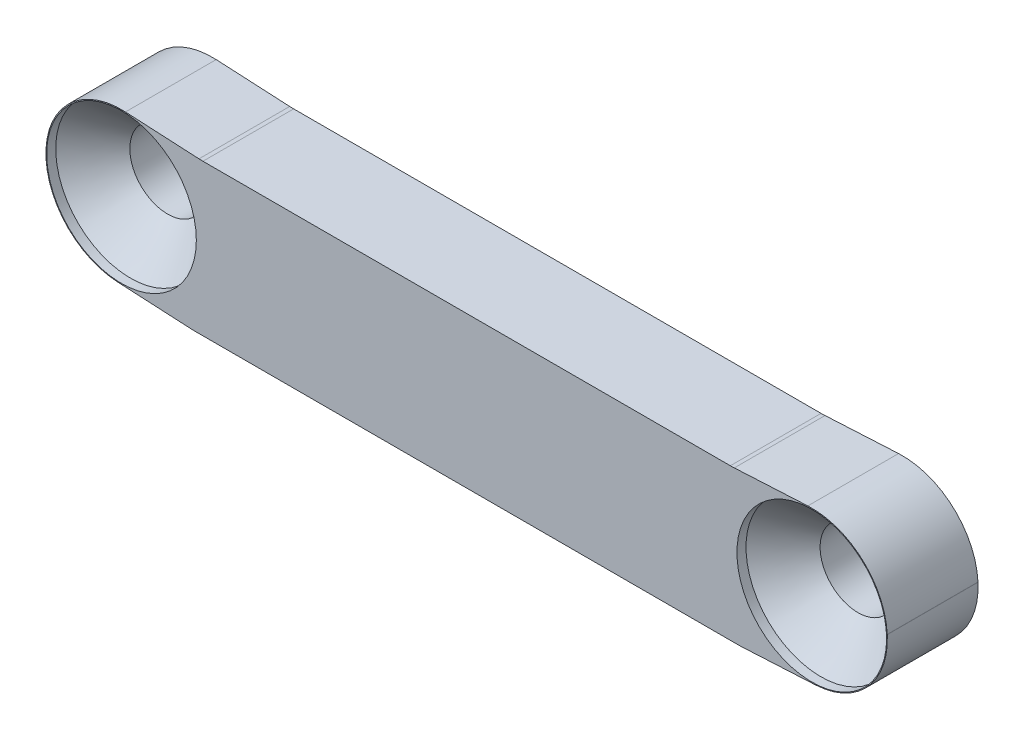
from build123d import *

# Parameters (mm, degrees)
SKETCH1_R                                      = 1.25
BOSS_EXTRUDE1_DEPTH                            = 3
FILLET1_R                                      = 2.5
CSK_FOR_M2_5_FLAT_HEAD_MACHINE_SCREW2_AT_COUNT = 2
CSK_FOR_M2_5_FLAT_HEAD_MACHINE_SCREW2_AT_PITCH = 22.827023493


with BuildPart() as part:
    # Sketch1 → Boss-Extrude1 (new body)
    with BuildSketch(Plane.XY):
        Polygon((-14.040925474, -24.298454927), (-9.0477778, -24.560134708), (9.0477778, -24.560134708), (14.040925474, -24.298454927), (13.778886578, -19.298454927), (8.785738904, -19.560134708), (-8.785738904, -19.560134708), (-13.778886578, -19.298454927), align=None)
        with Locations((11.413511747, -21.93272098)):
            Circle(SKETCH1_R, mode=Mode.SUBTRACT)
        with Locations((-11.413511747, -21.93272098)):
            Circle(SKETCH1_R, mode=Mode.SUBTRACT)
    extrude(amount=BOSS_EXTRUDE1_DEPTH)

    # Fillet1
    fillet1_edges = [part.edges().sort_by_distance(p)[0] for p in [
        (-9.0477778, -24.560134708, 1.5),
        (-14.040925474, -24.298454927, 1.5),
        (-13.778886578, -19.298454927, 1.5),
        (-8.785738904, -19.560134708, 1.5),
        (8.785738904, -19.560134708, 1.5),
        (13.778886578, -19.298454927, 1.5),
        (14.040925474, -24.298454927, 1.5),
        (9.0477778, -24.560134708, 1.5),
    ]]
    fillet(fillet1_edges, radius=FILLET1_R)

    # Sketch5 → CSK for M2.5 Flat Head Machine Screw2 (revolve, cut)
    with BuildSketch(Plane(origin=(-11.413511747, -21.93272098, 3), x_dir=(0, -1, 0), z_dir=(1, 0, 0))):
        Polygon((0, 0), (0, 5.751075774), (1.25, 5), (1.25, 1.525), (2.475, 0.3), (2.475, 0), align=None)
    csk_for_m2_5_flat_head_machine_screw2 = revolve(axis=Axis((-11.413511747, -21.93272098, 9.35), (0, 0, -1)), mode=Mode.SUBTRACT)

    # CSK for M2.5 Flat Head Machine Screw2 at: CSK for M2.5 Flat Head Machine Screw2 ×2
    with Locations(*[(i * CSK_FOR_M2_5_FLAT_HEAD_MACHINE_SCREW2_AT_PITCH, 0, 0) for i in range(1, CSK_FOR_M2_5_FLAT_HEAD_MACHINE_SCREW2_AT_COUNT)]):
        add(csk_for_m2_5_flat_head_machine_screw2, mode=Mode.SUBTRACT)


solid = part.part
